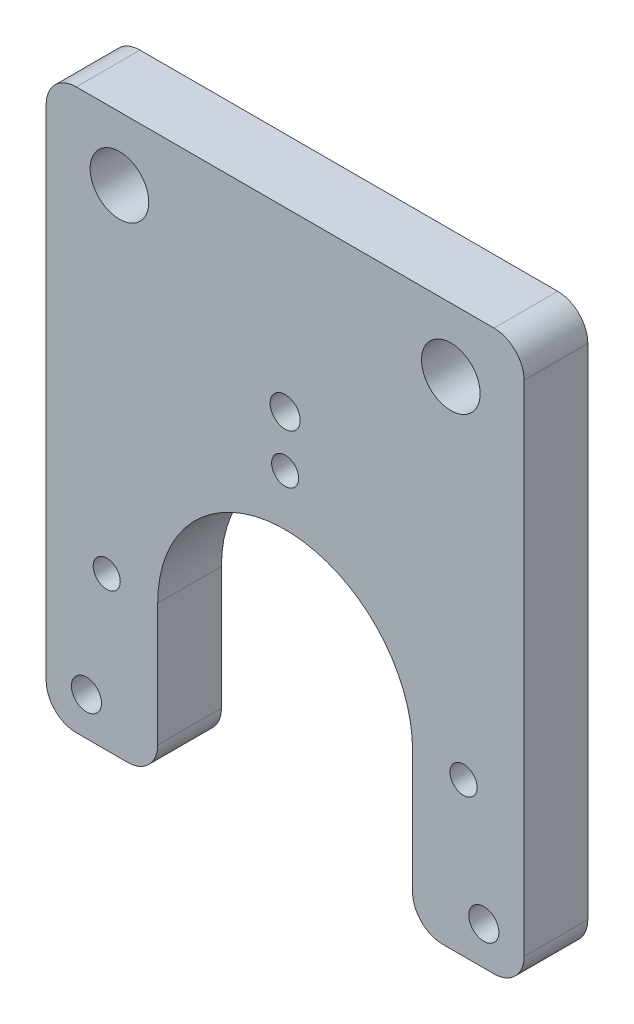
from build123d import *

# Parameters (mm, degrees)
SKETCH1_R           = 2.921
SKETCH1_R_2         = 1.35
SKETCH1_R_3         = 1.5
BOSS_EXTRUDE1_DEPTH = 6.35
FILLET1_R           = 3


with BuildPart() as part:
    # Sketch1 → Boss-Extrude1 (new body)
    with BuildSketch(Plane.XY):
        with BuildLine():
            Line((0, 0), (11.1125, 0))
            Line((11.1125, 0), (11.1125, 15.24))
            ThreePointArc((11.1125, 15.24), (23.8125, 27.94), (36.5125, 15.24))
            Line((36.5125, 15.24), (36.5125, 0))
            Line((36.5125, 0), (47.625, 0))
            Line((47.625, 0), (47.625, 55.738))
            Line((47.625, 55.738), (0, 55.738))
            Line((0, 55.738), (0, 0))
        make_face()
        with Locations((7.3025, 49.388)):
            Circle(SKETCH1_R, mode=Mode.SUBTRACT)
        with Locations((40.3225, 49.388)):
            Circle(SKETCH1_R, mode=Mode.SUBTRACT)
        with Locations((6.0325, 15.24)):
            Circle(SKETCH1_R_2, mode=Mode.SUBTRACT)
        with Locations((23.8125, 33.02)):
            Circle(SKETCH1_R_2, mode=Mode.SUBTRACT)
        with Locations((41.5925, 15.24)):
            Circle(SKETCH1_R_2, mode=Mode.SUBTRACT)
        with Locations((23.8125, 38.1)):
            Circle(SKETCH1_R_3, mode=Mode.SUBTRACT)
        with Locations((43.609840731, 3.81)):
            Circle(SKETCH1_R_3, mode=Mode.SUBTRACT)
        with Locations((4.015159269, 3.81)):
            Circle(SKETCH1_R_3, mode=Mode.SUBTRACT)
    extrude(amount=BOSS_EXTRUDE1_DEPTH)

    # Fillet1
    fillet1_edges = [part.edges().sort_by_distance(p)[0] for p in [
        (11.1125, 0, 3.175),
        (0, 0, 3.175),
        (0, 55.738, 3.175),
        (47.625, 55.738, 3.175),
        (47.625, 0, 3.175),
        (36.5125, 0, 3.175),
    ]]
    fillet(fillet1_edges, radius=FILLET1_R)


solid = part.part
